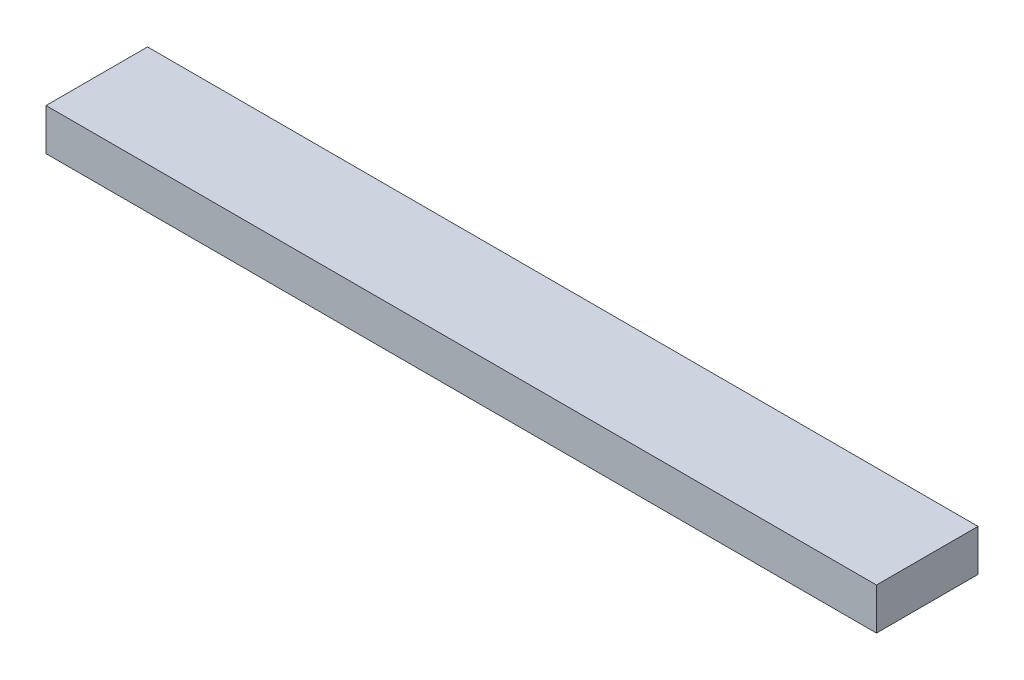
from build123d import *

# Parameters (mm, degrees)
SKETCH_1_W          = 63.8
SKETCH_1_H          = 7.8
EXTRUDE_2_DEPTH     = 3.2
SKETCH_1_7_R        = 2.5
CUT_EXTRUDE_4_DEPTH = 1.8


with BuildPart() as part:
    # Эскиз1 → Бобышка-Вытянуть2 (new body)
    with BuildSketch(Plane(origin=(0, 0, 0), x_dir=(1, 0, 0), z_dir=(0, 1, 0))):
        Rectangle(SKETCH_1_W, SKETCH_1_H)
    extrude(amount=EXTRUDE_2_DEPTH)

    # Эскиз1<7> → Вырез-Вытянуть4 (cut)
    with BuildSketch(Plane(origin=(0, 0, 0), x_dir=(1, 0, 0), z_dir=(0, 1, 0))):
        with Locations((-28, 0)):
            Circle(SKETCH_1_7_R)
        with Locations((-20, 0)):
            Circle(SKETCH_1_7_R)
        with Locations((-12, 0)):
            Circle(SKETCH_1_7_R)
        with Locations((-4, 0)):
            Circle(SKETCH_1_7_R)
        with Locations((4, 0)):
            Circle(SKETCH_1_7_R)
        with Locations((12, 0)):
            Circle(SKETCH_1_7_R)
        with Locations((20, 0)):
            Circle(SKETCH_1_7_R)
        with Locations((28, 0)):
            Circle(SKETCH_1_7_R)
    extrude(amount=CUT_EXTRUDE_4_DEPTH, mode=Mode.SUBTRACT)


solid = part.part
